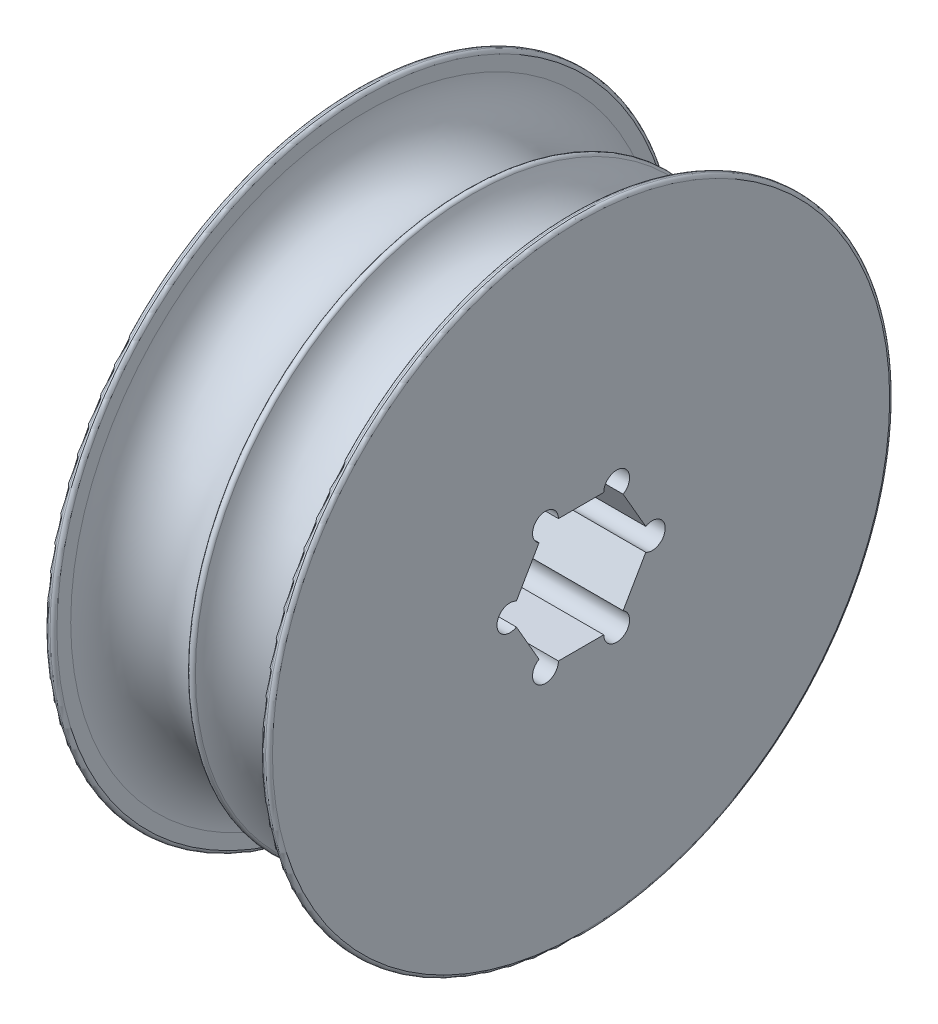
from build123d import *

# Parameters (mm, degrees)
CUT_EXTRUDE1_DEPTH      = 29.709231965
CUT_EXTRUDE1_DEPTH_BACK = 29.709231965
FILLET1_R               = 0.2


with BuildPart() as part:
    # Sketch1 → Revolve1 (revolve)
    with BuildSketch(Plane(origin=(0, 0, 0), x_dir=(1, 0, 0), z_dir=(0, 1, 0)), mode=Mode.PRIVATE) as revolve1_sk:
        with BuildLine():
            Line((-13, 0), (0, 0))
            Line((0, 0), (0, 18.1))
            Line((0, 18.1), (-0.5, 18.1))
            Line((-0.5, 18.1), (-0.5, 17.1))
            ThreePointArc((-0.5, 17.1), (-3.5, 14.1), (-6.5, 17.1))
            ThreePointArc((-6.5, 17.1), (-9.5, 14.1), (-12.5, 17.1))
            Line((-12.5, 17.1), (-12.5, 18.1))
            Line((-12.5, 18.1), (-13, 18.1))
            Line((-13, 18.1), (-13, 0))
        make_face()
    revolve(revolve1_sk.sketch.rotate(Axis((-13, 0, 0), (1, 0, 0)), 180), axis=Axis((-13, 0, 0), (1, 0, 0)))

    # Sketch2 → Cut-Extrude1 (cut, two sides: drawn at the far end of the back side and taken through both)
    with BuildSketch(Plane(origin=(0, 0, 0), x_dir=(0, 0, -1), z_dir=(1, 0, 0)).offset(-CUT_EXTRUDE1_DEPTH_BACK)):
        with BuildLine():
            Line((-1.314027212, 3.575), (1.314027212, 3.575))
            ThreePointArc((1.314027212, 3.575), (2.439027212, 4.224519053), (2.439027212, 2.925480947))
            Line((2.439027212, 2.925480947), (3.753054425, 0.649519053))
            ThreePointArc((3.753054425, 0.649519053), (4.878054425, 0), (3.753054425, -0.649519053))
            Line((3.753054425, -0.649519053), (2.439027212, -2.925480947))
            ThreePointArc((2.439027212, -2.925480947), (2.439027212, -4.224519053), (1.314027212, -3.575))
            Line((1.314027212, -3.575), (-1.314027212, -3.575))
            ThreePointArc((-1.314027212, -3.575), (-2.439027212, -4.224519053), (-2.439027212, -2.925480947))
            Line((-2.439027212, -2.925480947), (-3.753054425, -0.649519053))
            ThreePointArc((-3.753054425, -0.649519053), (-4.878054425, 0), (-3.753054425, 0.649519053))
            Line((-3.753054425, 0.649519053), (-2.439027212, 2.925480947))
            ThreePointArc((-2.439027212, 2.925480947), (-2.439027212, 4.224519053), (-1.314027212, 3.575))
        make_face()
    extrude(amount=CUT_EXTRUDE1_DEPTH + CUT_EXTRUDE1_DEPTH_BACK, mode=Mode.SUBTRACT)

    # Fillet1
    fillet1_edges = [part.edges().sort_by_distance(p)[0] for p in [
        (-0.5, 0, -18.1),
        (0, 0, -18.1),
        (-13, 0, -18.1),
        (-12.5, 0, -18.1),
        (-6.5, 0, -17.1),
    ]]
    fillet(fillet1_edges, radius=FILLET1_R)


solid = part.part
